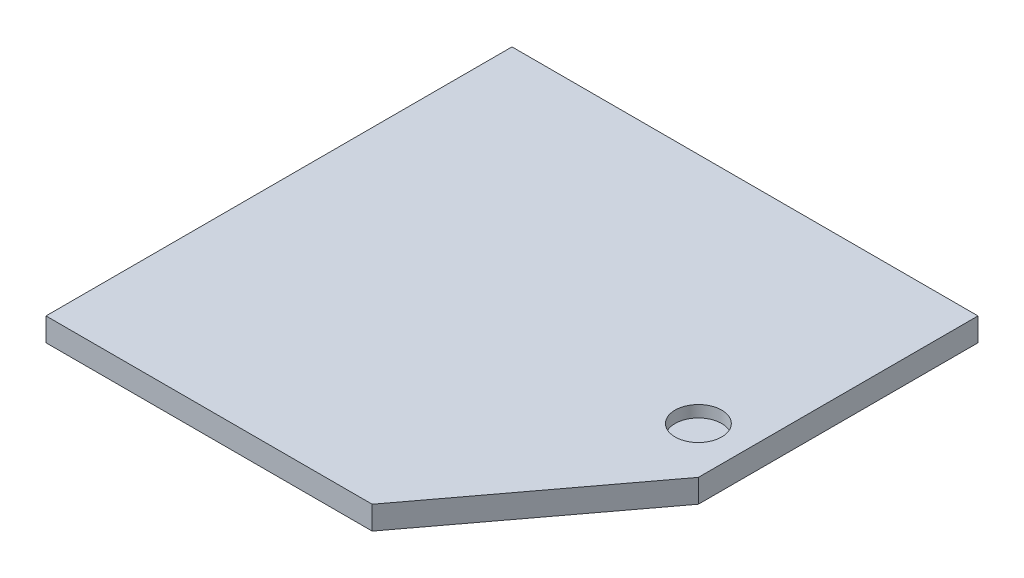
from build123d import *

# Parameters (mm, degrees)
EXTRUDE_1_DEPTH     = 10
SKETCH_2_R          = 10
CUT_EXTRUDE_1_DEPTH = 5


with BuildPart() as part:
    # Эскиз1 → Бобышка-Вытянуть1 (new body)
    with BuildSketch(Plane(origin=(0, 0, 0), x_dir=(1, 0, 0), z_dir=(0, 1, 0))):
        Polygon((0, 0), (140, 0), (200, 80), (200, 120), (200, 200), (140, 200), (0, 200), align=None)
    extrude(amount=EXTRUDE_1_DEPTH)

    # Эскиз2 → Вырез-Вытянуть1 (cut)
    with BuildSketch(Plane(origin=(0, 10, 0), x_dir=(1, 0, 0), z_dir=(0, 1, 0))):
        with Locations(Location((180, 100, 0), (0, 0, 270))):
            Circle(SKETCH_2_R)
    extrude(amount=-CUT_EXTRUDE_1_DEPTH, mode=Mode.SUBTRACT)


solid = part.part
